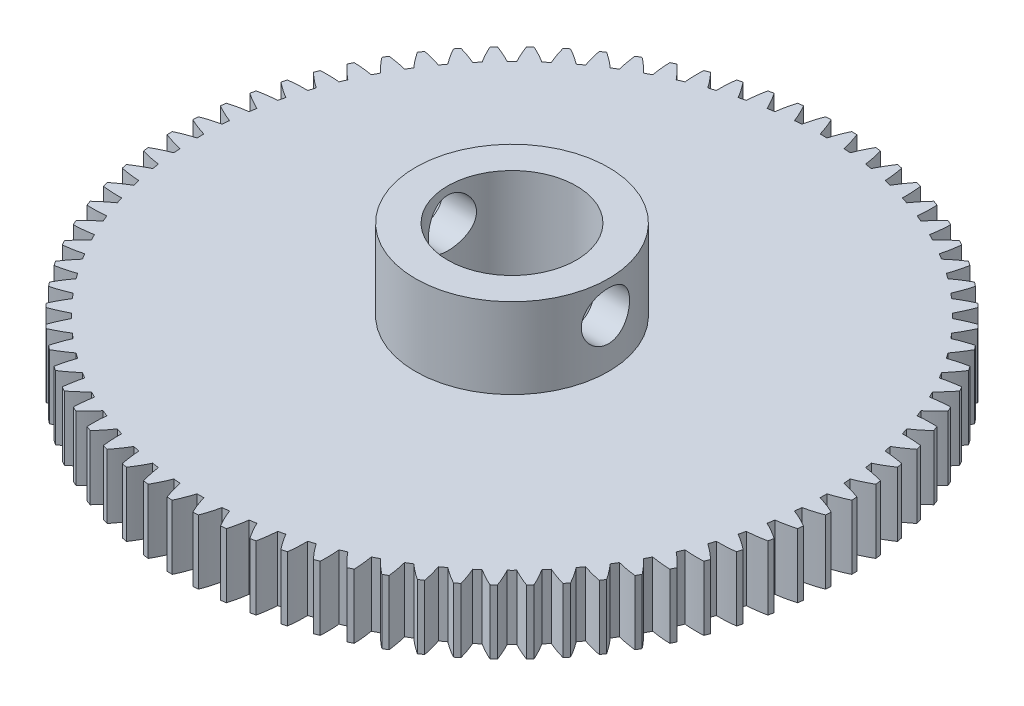
from build123d import *

# Parameters (mm, degrees)
SKETCH_1_R               = 0.4
EXTRUDE_1_DEPTH          = 4
SKETCH_2_R               = 6
EXTRUDE_2_DEPTH          = 5
SKETCH_3_R               = 4
CUT_EXTRUDE_1_DEPTH      = 31.342722335
CUT_EXTRUDE_3_DEPTH      = 31.342722335
CUT_EXTRUDE_3_DEPTH_BACK = 31.342722335
SKETCH_5_R               = 1.5


with BuildPart() as part:
    # ｽｹｯﾁ1 → ﾎﾞｽ - 押し出し1 (new body)
    with BuildSketch(Plane(origin=(0, 0, 0), x_dir=(1, 0, 0), z_dir=(0, 1, 0))):
        with BuildLine():
            ThreePointArc((-20.490007305, 0.640000509), (-19.939485125, 0.404140641), (-19.372860459, 0.210127665))
            ThreePointArc((-19.372860459, 0.210127665), (-19.374, 0), (-19.372860459, -0.210127665))
            ThreePointArc((-19.372860459, -0.210127665), (-19.939485125, -0.404140641), (-20.490007305, -0.640000509))
            ThreePointArc((-20.490007305, -0.640000509), (-20.484195243, -0.804826223), (-20.477057312, -0.969599844))
            ThreePointArc((-20.477057312, -0.969599844), (-19.909726856, -1.161539162), (-19.329626822, -1.310497202))
            ThreePointArc((-19.329626822, -1.310497202), (-19.314276424, -1.520066521), (-19.296653969, -1.729457025))
            ThreePointArc((-19.296653969, -1.729457025), (-19.846309838, -1.967328783), (-20.376629589, -2.245655045))
            ThreePointArc((-20.376629589, -2.245655045), (-20.357903368, -2.409516648), (-20.337859451, -2.573222291))
            ThreePointArc((-20.337859451, -2.573222291), (-19.757218501, -2.720057689), (-19.167219608, -2.823042418))
            ThreePointArc((-19.167219608, -2.823042418), (-19.135473911, -3.030761326), (-19.101477191, -3.238123707))
            ThreePointArc((-19.101477191, -3.238123707), (-19.630775451, -3.518387688), (-20.137623176, -3.837464372))
            ThreePointArc((-20.137623176, -3.837464372), (-20.106098248, -3.999351601), (-20.073271924, -4.160979967))
            ThreePointArc((-20.073271924, -4.160979967), (-19.482900323, -4.261806157), (-18.886640112, -4.318182638))
            ThreePointArc((-18.886640112, -4.318182638), (-18.838694838, -4.522770479), (-18.788533453, -4.726826279))
            ThreePointArc((-18.788533453, -4.726826279), (-19.294210805, -5.047754563), (-19.77446162, -5.405614455))
            ThreePointArc((-19.77446162, -5.405614455), (-19.730332347, -5.564529222), (-19.684926, -5.723083818))
            ThreePointArc((-19.684926, -5.723083818), (-19.088463586, -5.777279172), (-18.489618198, -5.786699827))
            ThreePointArc((-18.489618198, -5.786699827), (-18.425768947, -5.986895249), (-18.359752159, -6.186386396))
            ThreePointArc((-18.359752159, -6.186386396), (-18.838690934, -6.546000353), (-19.289383933, -6.940437126))
            ThreePointArc((-19.289383933, -6.940437126), (-19.232922387, -7.09539967), (-19.175215961, -7.249902954))
            ThreePointArc((-19.175215961, -7.249902954), (-18.576340124, -7.257133341), (-17.97860164, -7.219540087))
            ThreePointArc((-17.97860164, -7.219540087), (-17.899242063, -7.414108819), (-17.817776888, -7.607805384))
            ThreePointArc((-17.817776888, -7.607805384), (-18.267024268, -8.003887874), (-18.685380779, -8.432469696))
            ThreePointArc((-18.685380779, -8.432469696), (-18.616935064, -8.58252462), (-18.54728434, -8.732024027))
            ThreePointArc((-18.54728434, -8.732024027), (-17.949687347, -8.692244869), (-17.356741025, -8.607869481))
            ThreePointArc((-17.356741025, -8.607869481), (-17.2623604, -8.795611942), (-17.165949098, -8.982319721))
            ThreePointArc((-17.165949098, -8.982319721), (-17.582735324, -9.412428765), (-17.966176038, -9.872513285))
            ThreePointArc((-17.966176038, -9.872513285), (-17.886168145, -10.016735451), (-17.805002543, -10.160309269))
            ThreePointArc((-17.805002543, -10.160309269), (-17.212368779, -10.073765816), (-16.627870329, -9.943128498))
            ThreePointArc((-16.627870329, -9.943128498), (-16.519050544, -10.122887193), (-16.408287523, -10.301455071))
            ThreePointArc((-16.408287523, -10.301455071), (-16.790042969, -10.762938902), (-17.136203849, -11.251689547))
            ThreePointArc((-17.136203849, -11.251689547), (-17.045127052, -11.389189777), (-16.952946985, -11.525952825))
            ThreePointArc((-16.952946985, -11.525952825), (-16.368930234, -11.393178648), (-15.796483284, -11.217084821))
            ThreePointArc((-15.796483284, -11.217084821), (-15.673895249, -11.387751478), (-15.549463399, -11.557078524))
            ThreePointArc((-15.549463399, -11.557078524), (-15.893834417, -12.047091942), (-16.200581264, -12.561495401))
            ThreePointArc((-16.200581264, -12.561495401), (-16.098997083, -12.691425961), (-15.996370871, -12.820535049))
            ThreePointArc((-15.996370871, -12.820535049), (-15.424571791, -12.642348745), (-14.867705666, -12.421884086))
            ThreePointArc((-14.867705666, -12.421884086), (-14.732105178, -12.582406488), (-14.594771662, -12.741448746))
            ThreePointArc((-14.594771662, -12.741448746), (-14.89963509, -13.256970654), (-15.165076708, -13.793855459))
            ThreePointArc((-15.165076708, -13.793855459), (-15.053611444, -13.915415284), (-14.941171812, -14.036074412))
            ThreePointArc((-14.941171812, -14.036074412), (-14.385115733, -13.813574558), (-13.847263698, -13.550098305))
            ThreePointArc((-13.847263698, -13.550098305), (-13.699486779, -13.699486779), (-13.550098305, -13.847263698))
            ThreePointArc((-13.550098305, -13.847263698), (-13.813574558, -14.385115733), (-14.036074412, -14.941171812))
            ThreePointArc((-14.036074412, -14.941171812), (-13.915415284, -15.053611444), (-13.793855459, -15.165076708))
            ThreePointArc((-13.793855459, -15.165076708), (-13.256970654, -14.89963509), (-12.741448746, -14.594771662))
            ThreePointArc((-12.741448746, -14.594771662), (-12.582406488, -14.732105178), (-12.421884086, -14.867705666))
            ThreePointArc((-12.421884086, -14.867705666), (-12.642348745, -15.424571791), (-12.82053505, -15.996370871))
            ThreePointArc((-12.82053505, -15.996370871), (-12.691425961, -16.098997083), (-12.561495401, -16.200581264))
            ThreePointArc((-12.561495401, -16.200581264), (-12.047091942, -15.893834417), (-11.557078524, -15.549463399))
            ThreePointArc((-11.557078524, -15.549463399), (-11.387751478, -15.673895249), (-11.217084821, -15.796483284))
            ThreePointArc((-11.217084821, -15.796483284), (-11.393178648, -16.368930234), (-11.525952825, -16.952946985))
            ThreePointArc((-11.525952825, -16.952946985), (-11.389189777, -17.045127052), (-11.251689547, -17.136203849))
            ThreePointArc((-11.251689547, -17.136203849), (-10.762938902, -16.790042969), (-10.301455071, -16.408287523))
            ThreePointArc((-10.301455071, -16.408287523), (-10.122887193, -16.519050544), (-9.943128498, -16.627870329))
            ThreePointArc((-9.943128498, -16.627870329), (-10.073765816, -17.212368779), (-10.160309269, -17.805002543))
            ThreePointArc((-10.160309269, -17.805002543), (-10.016735451, -17.886168145), (-9.872513285, -17.966176039))
            ThreePointArc((-9.872513285, -17.966176039), (-9.412428765, -17.582735324), (-8.982319722, -17.165949098))
            ThreePointArc((-8.982319722, -17.165949098), (-8.795611942, -17.2623604), (-8.607869481, -17.356741025))
            ThreePointArc((-8.607869481, -17.356741025), (-8.692244869, -17.949687347), (-8.732024027, -18.54728434))
            ThreePointArc((-8.732024027, -18.54728434), (-8.58252462, -18.616935064), (-8.432469696, -18.685380779))
            ThreePointArc((-8.432469696, -18.685380779), (-8.003887874, -18.267024268), (-7.607805384, -17.817776889))
            ThreePointArc((-7.607805384, -17.817776889), (-7.414108819, -17.899242063), (-7.219540087, -17.978601641))
            ThreePointArc((-7.219540087, -17.978601641), (-7.257133341, -18.576340124), (-7.249902954, -19.175215961))
            ThreePointArc((-7.249902954, -19.175215961), (-7.09539967, -19.232922386), (-6.940437126, -19.289383932))
            ThreePointArc((-6.940437126, -19.289383932), (-6.546000353, -18.838690934), (-6.186386396, -18.359752159))
            ThreePointArc((-6.186386396, -18.359752159), (-5.986895249, -18.425768947), (-5.786699827, -18.489618198))
            ThreePointArc((-5.786699827, -18.489618198), (-5.777279172, -19.088463586), (-5.723083818, -19.684926))
            ThreePointArc((-5.723083818, -19.684926), (-5.564529222, -19.730332347), (-5.405614455, -19.77446162))
            ThreePointArc((-5.405614455, -19.77446162), (-5.047754563, -19.294210805), (-4.726826279, -18.788533453))
            ThreePointArc((-4.726826279, -18.788533453), (-4.522770479, -18.838694838), (-4.318182638, -18.886640112))
            ThreePointArc((-4.318182638, -18.886640112), (-4.261806157, -19.482900323), (-4.160979967, -20.073271924))
            ThreePointArc((-4.160979967, -20.073271924), (-3.999351601, -20.106098248), (-3.837464372, -20.137623176))
            ThreePointArc((-3.837464372, -20.137623176), (-3.518387688, -19.630775451), (-3.238123707, -19.101477191))
            ThreePointArc((-3.238123707, -19.101477191), (-3.030761326, -19.135473911), (-2.823042418, -19.167219608))
            ThreePointArc((-2.823042418, -19.167219608), (-2.720057689, -19.757218501), (-2.573222291, -20.337859451))
            ThreePointArc((-2.573222291, -20.337859451), (-2.409516648, -20.357903368), (-2.245655045, -20.376629589))
            ThreePointArc((-2.245655045, -20.376629589), (-1.967328783, -19.846309838), (-1.729457025, -19.296653969))
            ThreePointArc((-1.729457025, -19.296653969), (-1.520066521, -19.314276424), (-1.310497202, -19.329626822))
            ThreePointArc((-1.310497202, -19.329626822), (-1.161539162, -19.909726856), (-0.969599844, -20.477057312))
            ThreePointArc((-0.969599844, -20.477057312), (-0.804826223, -20.484195243), (-0.640000509, -20.490007305))
            ThreePointArc((-0.640000509, -20.490007305), (-0.404140641, -19.939485125), (-0.210127665, -19.372860459))
            ThreePointArc((-0.210127665, -19.372860459), (0, -19.374), (0.210127665, -19.372860459))
            ThreePointArc((0.210127665, -19.372860459), (0.404140641, -19.939485125), (0.640000509, -20.490007305))
            ThreePointArc((0.640000509, -20.490007305), (0.804826223, -20.484195243), (0.969599844, -20.477057312))
            ThreePointArc((0.969599844, -20.477057312), (1.161539162, -19.909726856), (1.310497202, -19.329626822))
            ThreePointArc((1.310497202, -19.329626822), (1.520066521, -19.314276424), (1.729457025, -19.296653969))
            ThreePointArc((1.729457025, -19.296653969), (1.967328783, -19.846309838), (2.245655045, -20.376629589))
            ThreePointArc((2.245655045, -20.376629589), (2.409516648, -20.357903368), (2.573222291, -20.337859451))
            ThreePointArc((2.573222291, -20.337859451), (2.720057689, -19.757218501), (2.823042418, -19.167219608))
            ThreePointArc((2.823042418, -19.167219608), (3.030761326, -19.135473911), (3.238123707, -19.101477191))
            ThreePointArc((3.238123707, -19.101477191), (3.518387688, -19.630775451), (3.837464372, -20.137623176))
            ThreePointArc((3.837464372, -20.137623176), (3.999351601, -20.106098248), (4.160979967, -20.073271924))
            ThreePointArc((4.160979967, -20.073271924), (4.261806157, -19.482900323), (4.318182638, -18.886640112))
            ThreePointArc((4.318182638, -18.886640112), (4.522770479, -18.838694838), (4.726826279, -18.788533453))
            ThreePointArc((4.726826279, -18.788533453), (5.047754563, -19.294210805), (5.405614455, -19.77446162))
            ThreePointArc((5.405614455, -19.77446162), (5.564529222, -19.730332347), (5.723083818, -19.684926))
            ThreePointArc((5.723083818, -19.684926), (5.777279172, -19.088463586), (5.786699827, -18.489618198))
            ThreePointArc((5.786699827, -18.489618198), (5.986895249, -18.425768947), (6.186386396, -18.359752159))
            ThreePointArc((6.186386396, -18.359752159), (6.546000353, -18.838690934), (6.940437126, -19.289383932))
            ThreePointArc((6.940437126, -19.289383932), (7.09539967, -19.232922386), (7.249902954, -19.175215961))
            ThreePointArc((7.249902954, -19.175215961), (7.257133341, -18.576340124), (7.219540086, -17.97860164))
            ThreePointArc((7.219540086, -17.97860164), (7.414108819, -17.899242063), (7.607805384, -17.817776888))
            ThreePointArc((7.607805384, -17.817776888), (8.003887874, -18.267024268), (8.432469695, -18.685380778))
            ThreePointArc((8.432469695, -18.685380778), (8.58252462, -18.616935063), (8.732024027, -18.54728434))
            ThreePointArc((8.732024027, -18.54728434), (8.692244869, -17.949687347), (8.607869481, -17.356741025))
            ThreePointArc((8.607869481, -17.356741025), (8.795611942, -17.2623604), (8.982319721, -17.165949098))
            ThreePointArc((8.982319721, -17.165949098), (9.412428765, -17.582735324), (9.872513285, -17.966176038))
            ThreePointArc((9.872513285, -17.966176038), (10.016735451, -17.886168145), (10.160309269, -17.805002543))
            ThreePointArc((10.160309269, -17.805002543), (10.073765816, -17.212368779), (9.943128498, -16.627870329))
            ThreePointArc((9.943128498, -16.627870329), (10.122887193, -16.519050544), (10.301455071, -16.408287523))
            ThreePointArc((10.301455071, -16.408287523), (10.762938902, -16.790042969), (11.251689547, -17.136203849))
            ThreePointArc((11.251689547, -17.136203849), (11.389189777, -17.045127052), (11.525952825, -16.952946985))
            ThreePointArc((11.525952825, -16.952946985), (11.393178648, -16.368930234), (11.217084821, -15.796483283))
            ThreePointArc((11.217084821, -15.796483283), (11.387751478, -15.673895249), (11.557078524, -15.549463399))
            ThreePointArc((11.557078524, -15.549463399), (12.047091942, -15.893834417), (12.561495401, -16.200581264))
            ThreePointArc((12.561495401, -16.200581264), (12.691425961, -16.098997083), (12.820535049, -15.996370871))
            ThreePointArc((12.820535049, -15.996370871), (12.642348745, -15.424571791), (12.421884086, -14.867705666))
            ThreePointArc((12.421884086, -14.867705666), (12.582406488, -14.732105178), (12.741448746, -14.594771662))
            ThreePointArc((12.741448746, -14.594771662), (13.256970654, -14.899635089), (13.793855459, -15.165076708))
            ThreePointArc((13.793855459, -15.165076708), (13.915415283, -15.053611443), (14.036074412, -14.941171812))
            ThreePointArc((14.036074412, -14.941171812), (13.813574557, -14.385115733), (13.550098305, -13.847263698))
            ThreePointArc((13.550098305, -13.847263698), (13.699486779, -13.699486779), (13.847263698, -13.550098305))
            ThreePointArc((13.847263698, -13.550098305), (14.385115733, -13.813574557), (14.941171812, -14.036074412))
            ThreePointArc((14.941171812, -14.036074412), (15.053611443, -13.915415283), (15.165076708, -13.793855459))
            ThreePointArc((15.165076708, -13.793855459), (14.899635089, -13.256970654), (14.594771662, -12.741448746))
            ThreePointArc((14.594771662, -12.741448746), (14.732105178, -12.582406488), (14.867705666, -12.421884086))
            ThreePointArc((14.867705666, -12.421884086), (15.424571791, -12.642348745), (15.996370871, -12.820535049))
            ThreePointArc((15.996370871, -12.820535049), (16.098997083, -12.691425961), (16.200581264, -12.561495401))
            ThreePointArc((16.200581264, -12.561495401), (15.893834417, -12.047091942), (15.549463399, -11.557078524))
            ThreePointArc((15.549463399, -11.557078524), (15.673895249, -11.387751478), (15.796483283, -11.217084821))
            ThreePointArc((15.796483283, -11.217084821), (16.368930234, -11.393178648), (16.952946985, -11.525952825))
            ThreePointArc((16.952946985, -11.525952825), (17.045127052, -11.389189777), (17.136203849, -11.251689547))
            ThreePointArc((17.136203849, -11.251689547), (16.790042969, -10.762938902), (16.408287523, -10.301455071))
            ThreePointArc((16.408287523, -10.301455071), (16.519050544, -10.122887193), (16.627870329, -9.943128498))
            ThreePointArc((16.627870329, -9.943128498), (17.212368779, -10.073765816), (17.805002543, -10.160309269))
            ThreePointArc((17.805002543, -10.160309269), (17.886168145, -10.016735451), (17.966176038, -9.872513285))
            ThreePointArc((17.966176038, -9.872513285), (17.582735324, -9.412428765), (17.165949098, -8.982319721))
            ThreePointArc((17.165949098, -8.982319721), (17.2623604, -8.795611942), (17.356741025, -8.607869481))
            ThreePointArc((17.356741025, -8.607869481), (17.949687347, -8.692244869), (18.54728434, -8.732024027))
            ThreePointArc((18.54728434, -8.732024027), (18.616935063, -8.58252462), (18.685380778, -8.432469696))
            ThreePointArc((18.685380778, -8.432469696), (18.267024268, -8.003887874), (17.817776888, -7.607805384))
            ThreePointArc((17.817776888, -7.607805384), (17.899242063, -7.414108819), (17.97860164, -7.219540086))
            ThreePointArc((17.97860164, -7.219540086), (18.576340124, -7.257133341), (19.175215961, -7.249902954))
            ThreePointArc((19.175215961, -7.249902954), (19.232922386, -7.09539967), (19.289383932, -6.940437126))
            ThreePointArc((19.289383932, -6.940437126), (18.838690934, -6.546000353), (18.359752159, -6.186386396))
            ThreePointArc((18.359752159, -6.186386396), (18.425768947, -5.986895249), (18.489618198, -5.786699827))
            ThreePointArc((18.489618198, -5.786699827), (19.088463586, -5.777279172), (19.684926, -5.723083818))
            ThreePointArc((19.684926, -5.723083818), (19.730332347, -5.564529222), (19.77446162, -5.405614455))
            ThreePointArc((19.77446162, -5.405614455), (19.294210805, -5.047754563), (18.788533453, -4.726826279))
            ThreePointArc((18.788533453, -4.726826279), (18.838694838, -4.522770479), (18.886640112, -4.318182638))
            ThreePointArc((18.886640112, -4.318182638), (19.482900323, -4.261806157), (20.073271924, -4.160979967))
            ThreePointArc((20.073271924, -4.160979967), (20.106098248, -3.999351601), (20.137623176, -3.837464372))
            ThreePointArc((20.137623176, -3.837464372), (19.630775451, -3.518387688), (19.101477191, -3.238123707))
            ThreePointArc((19.101477191, -3.238123707), (19.135473911, -3.030761326), (19.167219608, -2.823042418))
            ThreePointArc((19.167219608, -2.823042418), (19.757218501, -2.720057689), (20.337859451, -2.573222291))
            ThreePointArc((20.337859451, -2.573222291), (20.357903368, -2.409516648), (20.376629589, -2.245655045))
            ThreePointArc((20.376629589, -2.245655045), (19.846309838, -1.967328783), (19.296653969, -1.729457025))
            ThreePointArc((19.296653969, -1.729457025), (19.314276424, -1.520066521), (19.329626822, -1.310497202))
            ThreePointArc((19.329626822, -1.310497202), (19.909726856, -1.161539162), (20.477057312, -0.969599844))
            ThreePointArc((20.477057312, -0.969599844), (20.484195243, -0.804826223), (20.490007305, -0.640000509))
            ThreePointArc((20.490007305, -0.640000509), (19.939485125, -0.404140641), (19.372860459, -0.210127665))
            ThreePointArc((19.372860459, -0.210127665), (19.374, 0), (19.372860459, 0.210127665))
            ThreePointArc((19.372860459, 0.210127665), (19.939485125, 0.404140641), (20.490007305, 0.640000509))
            ThreePointArc((20.490007305, 0.640000509), (20.484195243, 0.804826223), (20.477057312, 0.969599844))
            ThreePointArc((20.477057312, 0.969599844), (19.909726856, 1.161539162), (19.329626822, 1.310497202))
            ThreePointArc((19.329626822, 1.310497202), (19.314276424, 1.520066521), (19.296653969, 1.729457025))
            ThreePointArc((19.296653969, 1.729457025), (19.846309838, 1.967328783), (20.376629589, 2.245655045))
            ThreePointArc((20.376629589, 2.245655045), (20.357903368, 2.409516648), (20.337859451, 2.573222291))
            ThreePointArc((20.337859451, 2.573222291), (19.757218501, 2.720057689), (19.167219608, 2.823042418))
            ThreePointArc((19.167219608, 2.823042418), (19.135473911, 3.030761326), (19.101477191, 3.238123707))
            ThreePointArc((19.101477191, 3.238123707), (19.630775451, 3.518387688), (20.137623176, 3.837464372))
            ThreePointArc((20.137623176, 3.837464372), (20.106098248, 3.999351601), (20.073271924, 4.160979967))
            ThreePointArc((20.073271924, 4.160979967), (19.482900323, 4.261806157), (18.886640112, 4.318182638))
            ThreePointArc((18.886640112, 4.318182638), (18.838694838, 4.522770479), (18.788533453, 4.726826279))
            ThreePointArc((18.788533453, 4.726826279), (19.294210805, 5.047754563), (19.77446162, 5.405614455))
            ThreePointArc((19.77446162, 5.405614455), (19.730332347, 5.564529222), (19.684926, 5.723083818))
            ThreePointArc((19.684926, 5.723083818), (19.088463586, 5.777279172), (18.489618198, 5.786699827))
            ThreePointArc((18.489618198, 5.786699827), (18.425768947, 5.986895249), (18.359752159, 6.186386396))
            ThreePointArc((18.359752159, 6.186386396), (18.838690934, 6.546000353), (19.289383932, 6.940437126))
            ThreePointArc((19.289383932, 6.940437126), (19.232922386, 7.09539967), (19.175215961, 7.249902954))
            ThreePointArc((19.175215961, 7.249902954), (18.576340124, 7.257133341), (17.97860164, 7.219540086))
            ThreePointArc((17.97860164, 7.219540086), (17.899242063, 7.414108819), (17.817776888, 7.607805384))
            ThreePointArc((17.817776888, 7.607805384), (18.267024268, 8.003887874), (18.685380778, 8.432469695))
            ThreePointArc((18.685380778, 8.432469695), (18.616935063, 8.58252462), (18.54728434, 8.732024027))
            ThreePointArc((18.54728434, 8.732024027), (17.949687347, 8.692244869), (17.356741025, 8.607869481))
            ThreePointArc((17.356741025, 8.607869481), (17.2623604, 8.795611942), (17.165949098, 8.982319721))
            ThreePointArc((17.165949098, 8.982319721), (17.582735324, 9.412428765), (17.966176038, 9.872513285))
            ThreePointArc((17.966176038, 9.872513285), (17.886168145, 10.016735451), (17.805002543, 10.160309269))
            ThreePointArc((17.805002543, 10.160309269), (17.212368779, 10.073765816), (16.627870329, 9.943128498))
            ThreePointArc((16.627870329, 9.943128498), (16.519050544, 10.122887193), (16.408287523, 10.301455071))
            ThreePointArc((16.408287523, 10.301455071), (16.790042969, 10.762938902), (17.136203849, 11.251689547))
            ThreePointArc((17.136203849, 11.251689547), (17.045127052, 11.389189777), (16.952946985, 11.525952825))
            ThreePointArc((16.952946985, 11.525952825), (16.368930234, 11.393178648), (15.796483283, 11.217084821))
            ThreePointArc((15.796483283, 11.217084821), (15.673895249, 11.387751478), (15.549463399, 11.557078524))
            ThreePointArc((15.549463399, 11.557078524), (15.893834417, 12.047091942), (16.200581264, 12.561495401))
            ThreePointArc((16.200581264, 12.561495401), (16.098997083, 12.691425961), (15.996370871, 12.820535049))
            ThreePointArc((15.996370871, 12.820535049), (15.424571791, 12.642348745), (14.867705666, 12.421884086))
            ThreePointArc((14.867705666, 12.421884086), (14.732105178, 12.582406488), (14.594771662, 12.741448746))
            ThreePointArc((14.594771662, 12.741448746), (14.899635089, 13.256970654), (15.165076708, 13.793855459))
            ThreePointArc((15.165076708, 13.793855459), (15.053611443, 13.915415283), (14.941171812, 14.036074412))
            ThreePointArc((14.941171812, 14.036074412), (14.385115733, 13.813574557), (13.847263698, 13.550098305))
            ThreePointArc((13.847263698, 13.550098305), (13.699486779, 13.699486779), (13.550098305, 13.847263698))
            ThreePointArc((13.550098305, 13.847263698), (13.813574557, 14.385115733), (14.036074412, 14.941171812))
            ThreePointArc((14.036074412, 14.941171812), (13.915415283, 15.053611443), (13.793855459, 15.165076708))
            ThreePointArc((13.793855459, 15.165076708), (13.256970654, 14.899635089), (12.741448746, 14.594771662))
            ThreePointArc((12.741448746, 14.594771662), (12.582406488, 14.732105178), (12.421884086, 14.867705666))
            ThreePointArc((12.421884086, 14.867705666), (12.642348745, 15.424571791), (12.820535049, 15.996370871))
            ThreePointArc((12.820535049, 15.996370871), (12.691425961, 16.098997083), (12.561495401, 16.200581264))
            ThreePointArc((12.561495401, 16.200581264), (12.047091942, 15.893834417), (11.557078524, 15.549463399))
            ThreePointArc((11.557078524, 15.549463399), (11.387751478, 15.673895249), (11.217084821, 15.796483283))
            ThreePointArc((11.217084821, 15.796483283), (11.393178648, 16.368930234), (11.525952825, 16.952946985))
            ThreePointArc((11.525952825, 16.952946985), (11.389189777, 17.045127052), (11.251689547, 17.136203849))
            ThreePointArc((11.251689547, 17.136203849), (10.762938902, 16.790042969), (10.301455071, 16.408287523))
            ThreePointArc((10.301455071, 16.408287523), (10.122887193, 16.519050544), (9.943128498, 16.627870329))
            ThreePointArc((9.943128498, 16.627870329), (10.073765816, 17.212368779), (10.160309269, 17.805002543))
            ThreePointArc((10.160309269, 17.805002543), (10.016735451, 17.886168145), (9.872513285, 17.966176038))
            ThreePointArc((9.872513285, 17.966176038), (9.412428765, 17.582735324), (8.982319721, 17.165949098))
            ThreePointArc((8.982319721, 17.165949098), (8.795611942, 17.2623604), (8.607869481, 17.356741025))
            ThreePointArc((8.607869481, 17.356741025), (8.692244869, 17.949687347), (8.732024027, 18.54728434))
            ThreePointArc((8.732024027, 18.54728434), (8.58252462, 18.616935063), (8.432469696, 18.685380778))
            ThreePointArc((8.432469696, 18.685380778), (8.003887874, 18.267024268), (7.607805384, 17.817776888))
            ThreePointArc((7.607805384, 17.817776888), (7.414108819, 17.899242063), (7.219540086, 17.97860164))
            ThreePointArc((7.219540086, 17.97860164), (7.257133341, 18.576340124), (7.249902954, 19.175215961))
            ThreePointArc((7.249902954, 19.175215961), (7.09539967, 19.232922386), (6.940437126, 19.289383932))
            ThreePointArc((6.940437126, 19.289383932), (6.546000353, 18.838690934), (6.186386396, 18.359752159))
            ThreePointArc((6.186386396, 18.359752159), (5.986895249, 18.425768947), (5.786699827, 18.489618198))
            ThreePointArc((5.786699827, 18.489618198), (5.777279172, 19.088463586), (5.723083818, 19.684926))
            ThreePointArc((5.723083818, 19.684926), (5.564529222, 19.730332347), (5.405614455, 19.77446162))
            ThreePointArc((5.405614455, 19.77446162), (5.047754563, 19.294210805), (4.726826279, 18.788533453))
            ThreePointArc((4.726826279, 18.788533453), (4.522770479, 18.838694838), (4.318182638, 18.886640112))
            ThreePointArc((4.318182638, 18.886640112), (4.261806157, 19.482900323), (4.160979967, 20.073271923))
            ThreePointArc((4.160979967, 20.073271923), (3.999351601, 20.106098248), (3.837464372, 20.137623176))
            ThreePointArc((3.837464372, 20.137623176), (3.518387688, 19.630775451), (3.238123707, 19.101477191))
            ThreePointArc((3.238123707, 19.101477191), (3.030761326, 19.135473911), (2.823042418, 19.167219608))
            ThreePointArc((2.823042418, 19.167219608), (2.720057689, 19.757218501), (2.573222291, 20.337859451))
            ThreePointArc((2.573222291, 20.337859451), (2.409516648, 20.357903368), (2.245655045, 20.376629589))
            ThreePointArc((2.245655045, 20.376629589), (1.967328783, 19.846309838), (1.729457025, 19.296653969))
            ThreePointArc((1.729457025, 19.296653969), (1.520066521, 19.314276424), (1.310497202, 19.329626822))
            ThreePointArc((1.310497202, 19.329626822), (1.161539162, 19.909726856), (0.969599844, 20.477057312))
            ThreePointArc((0.969599844, 20.477057312), (0.804826223, 20.484195243), (0.640000509, 20.490007305))
            ThreePointArc((0.640000509, 20.490007305), (0.404140641, 19.939485125), (0.210127665, 19.372860459))
            ThreePointArc((0.210127665, 19.372860459), (0, 19.374), (-0.210127665, 19.372860459))
            ThreePointArc((-0.210127665, 19.372860459), (-0.404140641, 19.939485125), (-0.640000509, 20.490007305))
            ThreePointArc((-0.640000509, 20.490007305), (-0.804826223, 20.484195243), (-0.969599844, 20.477057312))
            ThreePointArc((-0.969599844, 20.477057312), (-1.161539162, 19.909726856), (-1.310497202, 19.329626822))
            ThreePointArc((-1.310497202, 19.329626822), (-1.520066521, 19.314276424), (-1.729457025, 19.296653969))
            ThreePointArc((-1.729457025, 19.296653969), (-1.967328783, 19.846309838), (-2.245655045, 20.376629589))
            ThreePointArc((-2.245655045, 20.376629589), (-2.409516648, 20.357903368), (-2.573222291, 20.337859451))
            ThreePointArc((-2.573222291, 20.337859451), (-2.720057689, 19.757218501), (-2.823042418, 19.167219608))
            ThreePointArc((-2.823042418, 19.167219608), (-3.030761326, 19.135473911), (-3.238123707, 19.101477191))
            ThreePointArc((-3.238123707, 19.101477191), (-3.518387688, 19.630775451), (-3.837464372, 20.137623176))
            ThreePointArc((-3.837464372, 20.137623176), (-3.999351601, 20.106098248), (-4.160979967, 20.073271924))
            ThreePointArc((-4.160979967, 20.073271924), (-4.261806157, 19.482900323), (-4.318182638, 18.886640112))
            ThreePointArc((-4.318182638, 18.886640112), (-4.522770479, 18.838694838), (-4.726826279, 18.788533453))
            ThreePointArc((-4.726826279, 18.788533453), (-5.047754563, 19.294210805), (-5.405614455, 19.77446162))
            ThreePointArc((-5.405614455, 19.77446162), (-5.564529222, 19.730332347), (-5.723083818, 19.684926))
            ThreePointArc((-5.723083818, 19.684926), (-5.777279172, 19.088463586), (-5.786699827, 18.489618198))
            ThreePointArc((-5.786699827, 18.489618198), (-5.986895249, 18.425768947), (-6.186386396, 18.359752159))
            ThreePointArc((-6.186386396, 18.359752159), (-6.546000353, 18.838690934), (-6.940437126, 19.289383933))
            ThreePointArc((-6.940437126, 19.289383933), (-7.09539967, 19.232922386), (-7.249902954, 19.175215961))
            ThreePointArc((-7.249902954, 19.175215961), (-7.257133341, 18.576340124), (-7.219540086, 17.97860164))
            ThreePointArc((-7.219540086, 17.97860164), (-7.414108819, 17.899242063), (-7.607805384, 17.817776888))
            ThreePointArc((-7.607805384, 17.817776888), (-8.003887874, 18.267024268), (-8.432469695, 18.685380778))
            ThreePointArc((-8.432469695, 18.685380778), (-8.582524619, 18.616935063), (-8.732024027, 18.54728434))
            ThreePointArc((-8.732024027, 18.54728434), (-8.692244868, 17.949687347), (-8.607869481, 17.356741025))
            ThreePointArc((-8.607869481, 17.356741025), (-8.795611942, 17.262360399), (-8.982319721, 17.165949097))
            ThreePointArc((-8.982319721, 17.165949097), (-9.412428764, 17.582735324), (-9.872513285, 17.966176038))
            ThreePointArc((-9.872513285, 17.966176038), (-10.016735451, 17.886168145), (-10.160309269, 17.805002543))
            ThreePointArc((-10.160309269, 17.805002543), (-10.073765816, 17.212368779), (-9.943128498, 16.627870329))
            ThreePointArc((-9.943128498, 16.627870329), (-10.122887193, 16.519050544), (-10.301455071, 16.408287522))
            ThreePointArc((-10.301455071, 16.408287522), (-10.762938902, 16.790042969), (-11.251689547, 17.136203848))
            ThreePointArc((-11.251689547, 17.136203848), (-11.389189777, 17.045127052), (-11.525952825, 16.952946985))
            ThreePointArc((-11.525952825, 16.952946985), (-11.393178648, 16.368930234), (-11.217084821, 15.796483283))
            ThreePointArc((-11.217084821, 15.796483283), (-11.387751478, 15.673895249), (-11.557078524, 15.549463398))
            ThreePointArc((-11.557078524, 15.549463398), (-12.047091942, 15.893834416), (-12.561495401, 16.200581264))
            ThreePointArc((-12.561495401, 16.200581264), (-12.691425961, 16.098997083), (-12.820535049, 15.996370871))
            ThreePointArc((-12.820535049, 15.996370871), (-12.642348745, 15.424571791), (-12.421884086, 14.867705665))
            ThreePointArc((-12.421884086, 14.867705665), (-12.582406488, 14.732105177), (-12.741448745, 14.594771662))
            ThreePointArc((-12.741448745, 14.594771662), (-13.256970654, 14.899635089), (-13.793855459, 15.165076708))
            ThreePointArc((-13.793855459, 15.165076708), (-13.915415283, 15.053611443), (-14.036074412, 14.941171811))
            ThreePointArc((-14.036074412, 14.941171811), (-13.813574557, 14.385115733), (-13.550098305, 13.847263698))
            ThreePointArc((-13.550098305, 13.847263698), (-13.699486779, 13.699486779), (-13.847263698, 13.550098305))
            ThreePointArc((-13.847263698, 13.550098305), (-14.385115733, 13.813574557), (-14.941171811, 14.036074412))
            ThreePointArc((-14.941171811, 14.036074412), (-15.053611443, 13.915415283), (-15.165076708, 13.793855459))
            ThreePointArc((-15.165076708, 13.793855459), (-14.899635089, 13.256970654), (-14.594771662, 12.741448745))
            ThreePointArc((-14.594771662, 12.741448745), (-14.732105177, 12.582406488), (-14.867705665, 12.421884086))
            ThreePointArc((-14.867705665, 12.421884086), (-15.424571791, 12.642348745), (-15.996370871, 12.820535049))
            ThreePointArc((-15.996370871, 12.820535049), (-16.098997083, 12.691425961), (-16.200581264, 12.561495401))
            ThreePointArc((-16.200581264, 12.561495401), (-15.893834417, 12.047091942), (-15.549463398, 11.557078524))
            ThreePointArc((-15.549463398, 11.557078524), (-15.673895249, 11.387751478), (-15.796483283, 11.217084821))
            ThreePointArc((-15.796483283, 11.217084821), (-16.368930234, 11.393178648), (-16.952946985, 11.525952825))
            ThreePointArc((-16.952946985, 11.525952825), (-17.045127052, 11.389189777), (-17.136203849, 11.251689547))
            ThreePointArc((-17.136203849, 11.251689547), (-16.790042969, 10.762938902), (-16.408287522, 10.301455071))
            ThreePointArc((-16.408287522, 10.301455071), (-16.519050544, 10.122887193), (-16.627870329, 9.943128498))
            ThreePointArc((-16.627870329, 9.943128498), (-17.212368779, 10.073765816), (-17.805002543, 10.160309269))
            ThreePointArc((-17.805002543, 10.160309269), (-17.886168145, 10.016735451), (-17.966176038, 9.872513285))
            ThreePointArc((-17.966176038, 9.872513285), (-17.582735324, 9.412428765), (-17.165949098, 8.982319721))
            ThreePointArc((-17.165949098, 8.982319721), (-17.2623604, 8.795611942), (-17.356741025, 8.607869481))
            ThreePointArc((-17.356741025, 8.607869481), (-17.949687347, 8.692244869), (-18.54728434, 8.732024027))
            ThreePointArc((-18.54728434, 8.732024027), (-18.616935063, 8.582524619), (-18.685380778, 8.432469695))
            ThreePointArc((-18.685380778, 8.432469695), (-18.267024268, 8.003887874), (-17.817776888, 7.607805384))
            ThreePointArc((-17.817776888, 7.607805384), (-17.899242063, 7.414108819), (-17.97860164, 7.219540086))
            ThreePointArc((-17.97860164, 7.219540086), (-18.576340124, 7.257133341), (-19.175215961, 7.249902954))
            ThreePointArc((-19.175215961, 7.249902954), (-19.232922386, 7.09539967), (-19.289383932, 6.940437126))
            ThreePointArc((-19.289383932, 6.940437126), (-18.838690934, 6.546000353), (-18.359752159, 6.186386396))
            ThreePointArc((-18.359752159, 6.186386396), (-18.425768947, 5.986895249), (-18.489618198, 5.786699827))
            ThreePointArc((-18.489618198, 5.786699827), (-19.088463586, 5.777279172), (-19.684926, 5.723083818))
            ThreePointArc((-19.684926, 5.723083818), (-19.730332347, 5.564529222), (-19.77446162, 5.405614455))
            ThreePointArc((-19.77446162, 5.405614455), (-19.294210805, 5.047754563), (-18.788533453, 4.726826279))
            ThreePointArc((-18.788533453, 4.726826279), (-18.838694838, 4.522770479), (-18.886640112, 4.318182638))
            ThreePointArc((-18.886640112, 4.318182638), (-19.482900323, 4.261806157), (-20.073271923, 4.160979967))
            ThreePointArc((-20.073271923, 4.160979967), (-20.106098248, 3.999351601), (-20.137623176, 3.837464372))
            ThreePointArc((-20.137623176, 3.837464372), (-19.630775451, 3.518387688), (-19.10147719, 3.238123707))
            ThreePointArc((-19.10147719, 3.238123707), (-19.135473911, 3.030761326), (-19.167219608, 2.823042418))
            ThreePointArc((-19.167219608, 2.823042418), (-19.757218501, 2.720057689), (-20.337859451, 2.573222291))
            ThreePointArc((-20.337859451, 2.573222291), (-20.357903368, 2.409516648), (-20.376629589, 2.245655045))
            ThreePointArc((-20.376629589, 2.245655045), (-19.846309838, 1.967328783), (-19.296653969, 1.729457025))
            ThreePointArc((-19.296653969, 1.729457025), (-19.314276424, 1.520066521), (-19.329626822, 1.310497202))
            ThreePointArc((-19.329626822, 1.310497202), (-19.909726856, 1.161539162), (-20.477057312, 0.969599844))
            ThreePointArc((-20.477057312, 0.969599844), (-20.484195243, 0.804826223), (-20.490007305, 0.640000509))
        make_face()
        with Locations(Location((0, 0, 0), (0, 0, 270))):
            Circle(SKETCH_1_R, mode=Mode.SUBTRACT)
    extrude(amount=EXTRUDE_1_DEPTH)

    # ｽｹｯﾁ2 → ﾎﾞｽ - 押し出し2 (add)
    with BuildSketch(Plane(origin=(0, 4, 0), x_dir=(1, 0, 0), z_dir=(0, 1, 0))):
        with Locations(Location((0, 0, 0), (0, 0, 270))):
            Circle(SKETCH_2_R)
    extrude(amount=EXTRUDE_2_DEPTH)

    # ｽｹｯﾁ3 → ｶｯﾄ - 押し出し1 (cut, through all)
    with BuildSketch(Plane(origin=(0, 9, 0), x_dir=(1, 0, 0), z_dir=(0, 1, 0))):
        with Locations(Location((0, 0, 0), (0, 0, 270))):
            Circle(SKETCH_3_R)
    extrude(amount=-CUT_EXTRUDE_1_DEPTH, mode=Mode.SUBTRACT)

    # ｽｹｯﾁ5 → ｶｯﾄ - 押し出し3 (cut, two sides: drawn at the far end of the back side and taken through both)
    with BuildSketch(Plane(origin=(0, 0, 0), x_dir=(0, 0, -1), z_dir=(1, 0, 0)).offset(-CUT_EXTRUDE_3_DEPTH_BACK)):
        with Locations((0, 7)):
            Circle(SKETCH_5_R)
    extrude(amount=CUT_EXTRUDE_3_DEPTH + CUT_EXTRUDE_3_DEPTH_BACK, mode=Mode.SUBTRACT)


solid = part.part
